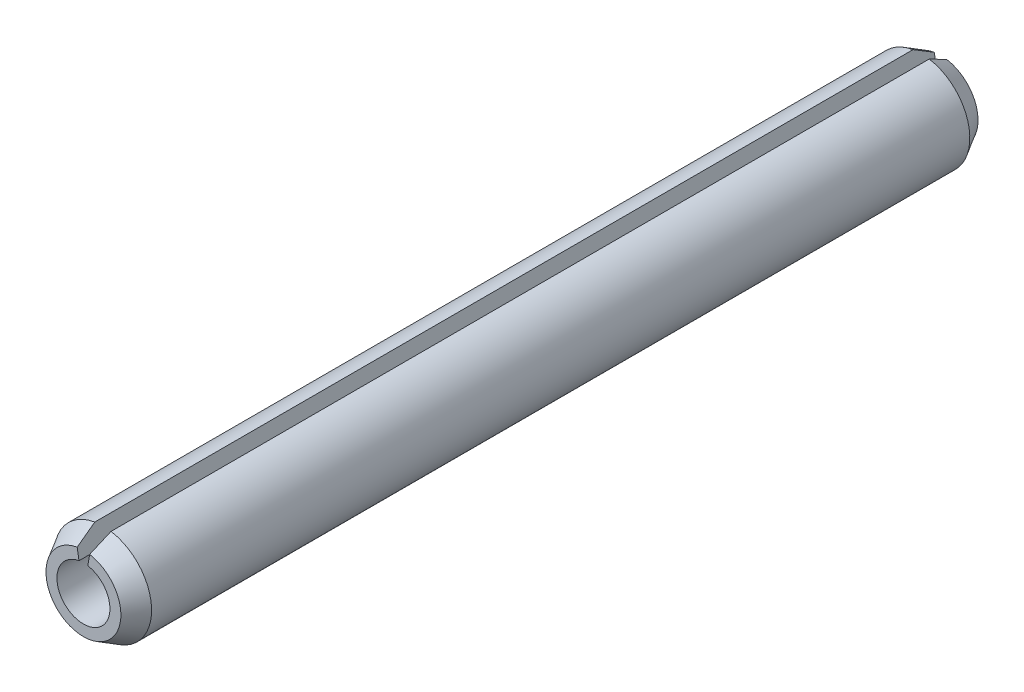
from build123d import *

# Parameters (mm, degrees)
BASE_EXTRUDE_THIN_DEPTH = 11
CHAMFER1_SIZE           = 0.5
CHAMFER1_SIZE2          = 0.288675135


with BuildPart() as part:
    # Sketch1 → Base-Extrude-Thin (new, symmetric)
    with BuildSketch(Plane.XY):
        with BuildLine():
            ThreePointArc((-0.208333333, 1.232516621), (0, -1.25), (0.208333333, 1.232516621))
            Line((0.208333333, 1.232516621), (0.113333333, 0.670489042))
            ThreePointArc((0.113333333, 0.670489042), (0, -0.68), (-0.113333333, 0.670489042))
            Line((-0.113333333, 0.670489042), (-0.208333333, 1.232516621))
        make_face()
    extrude(amount=BASE_EXTRUDE_THIN_DEPTH, both=True)

    # Chamfer1
    chamfer1_edges = [part.edges().sort_by_distance(p)[0] for p in [
        (0, -1.25, 11),
        (0, -1.25, -11),
    ]]
    chamfer1_side = [part.faces().sort_by_distance(p)[0] for p in [
        (0, -1.25, 0),
    ]]
    chamfer(chamfer1_edges, length=CHAMFER1_SIZE, length2=CHAMFER1_SIZE2, reference=chamfer1_side[0])


solid = part.part
